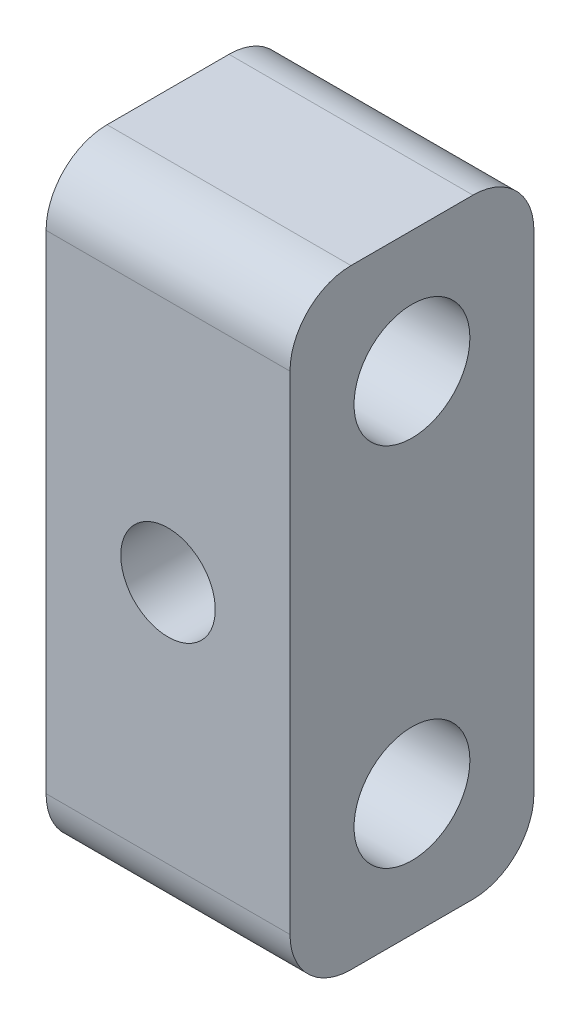
from build123d import *

# Parameters (mm, degrees)
ESQUISSE1_W             = 8
ESQUISSE1_H             = 20
ESQUISSE1_R             = 1.55
BOSS_EXTRU_1_DEPTH      = 8
ESQUISSE2_R             = 1.55
ENL_V_MAT_EXTRU_1_DEPTH = 16.099668871
ESQUISSE3_R             = 1.9
ENL_V_MAT_EXTRU_2_DEPTH = 3
ENL_V_MAT_EXTRU_3_DEPTH = 5
CONG_1_R                = 2


with BuildPart() as part:
    # Esquisse1 → Boss.-Extru.1 (new body)
    with BuildSketch(Plane(origin=(0, 0, 0), x_dir=(0, 0, -1), z_dir=(1, 0, 0))):
        Rectangle(ESQUISSE1_W, ESQUISSE1_H)
        with Locations((0, 6)):
            Circle(ESQUISSE1_R, mode=Mode.SUBTRACT)
        with Locations(Location((0, -6, 0), (0, 0, 180))):
            Circle(ESQUISSE1_R, mode=Mode.SUBTRACT)
    extrude(amount=BOSS_EXTRU_1_DEPTH)

    # Esquisse2 → Enlèv. mat.-Extru.1 (cut, through all)
    with BuildSketch(Plane(origin=(0, 0, -4), x_dir=(-1, 0, 0), z_dir=(0, 0, -1))):
        with Locations((-4, 0)):
            Circle(ESQUISSE2_R)
    extrude(amount=-ENL_V_MAT_EXTRU_1_DEPTH, mode=Mode.SUBTRACT)

    # Esquisse3 → Enlèv. mat.-Extru.2 (cut)
    with BuildSketch(Plane(origin=(8, 0, 0), x_dir=(0, 0, -1), z_dir=(1, 0, 0))):
        with Locations((0, 6)):
            Circle(ESQUISSE3_R)
        with Locations((0, -6)):
            Circle(ESQUISSE3_R)
    extrude(amount=-ENL_V_MAT_EXTRU_2_DEPTH, mode=Mode.SUBTRACT)

    # Esquisse4 → Enlèv. mat.-Extru.3 (cut)
    with BuildSketch(Plane(origin=(0, 0, -4), x_dir=(-1, 0, 0), z_dir=(0, 0, -1))):
        Polygon((-5.58771324, 2.75), (-7.175426481, 0), (-5.58771324, -2.75), (-2.41228676, -2.75), (-0.824573519, 0), (-2.41228676, 2.75), align=None)
    extrude(amount=-ENL_V_MAT_EXTRU_3_DEPTH, mode=Mode.SUBTRACT)

    # Congé1
    cong_1_edges = [part.edges().sort_by_distance(p)[0] for p in [
        (4, -10, -4),
        (4, -10, 4),
        (4, 10, 4),
        (4, 10, -4),
    ]]
    fillet(cong_1_edges, radius=CONG_1_R)


solid = part.part
